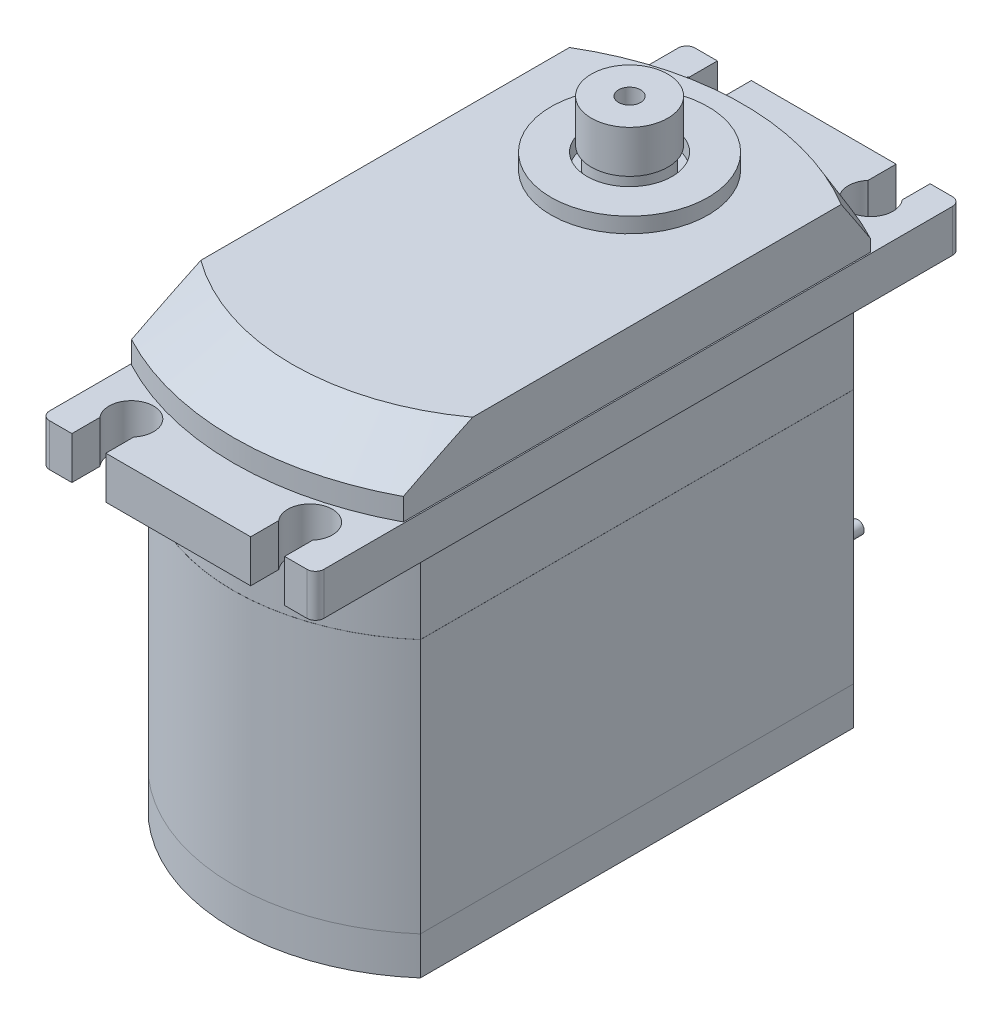
from build123d import *

# Parameters (mm, degrees)
SKETCH1_W            = 32
SKETCH1_H            = 63
BOSS_EXTRUDE1_DEPTH  = 35
SKETCH2_W            = 33
SKETCH2_H            = 63
BOSS_EXTRUDE2_DEPTH  = 7.5
BOSS_EXTRUDE3_DEPTH  = 5
CUT_EXTRUDE2_REACH   = 65.028
SKETCH6_W            = 63
SKETCH6_H            = 7.5
CUT_EXTRUDE3_DEPTH   = 0.5
SKETCH7_W            = 63
SKETCH7_H            = 7.5
CUT_EXTRUDE4_DEPTH   = 0.5
SKETCH8_W            = 32
SKETCH8_H            = 55
BOSS_EXTRUDE4_DEPTH  = 6.6
SKETCH9_R            = 9.25
SKETCH9_R_2          = 5
BOSS_EXTRUDE5_DEPTH  = 1.8
SKETCH10_R           = 4
BOSS_EXTRUDE6_DEPTH  = 2.5
SKETCH11_R           = 4.5
SKETCH11_R_2         = 1.3
BOSS_EXTRUDE7_DEPTH  = 5
BOSS_EXTRUDE8_START  = 30.5
SKETCH12_W           = 7.5
SKETCH12_H           = 4.5
BOSS_EXTRUDE8_DEPTH  = 7
SKETCH13_R           = 0.75
BOSS_EXTRUDE11_DEPTH = 3
SKETCH14_W           = 51
SKETCH14_H           = 30
BOSS_EXTRUDE12_DEPTH = 0.01
SKETCH15_W           = 51
SKETCH15_H           = 30
BOSS_EXTRUDE13_DEPTH = 0.01
CHAMFER1_SIZE        = 4
CHAMFER1_SIZE2       = 6.92820323
CHAMFER2_SIZE        = 3
CHAMFER2_SIZE2       = 5.196152423
CUT_EXTRUDE7_DEPTH   = 4.5
BOSS_EXTRUDE15_START = -4.5
BOSS_EXTRUDE15_DEPTH = 30
FILLET3_R            = 1


with BuildPart() as part:
    # Sketch1 → Boss-Extrude1 (new body)
    with BuildSketch(Plane(origin=(0, 0, 0), x_dir=(1, 0, 0), z_dir=(0, 1, 0))):
        Rectangle(SKETCH1_W, SKETCH1_H)
    extrude(amount=BOSS_EXTRUDE1_DEPTH)

    # Sketch2 → Boss-Extrude2 (add)
    with BuildSketch(Plane(origin=(0, 35, 0), x_dir=(1, 0, 0), z_dir=(0, 1, 0))):
        Rectangle(SKETCH2_W, SKETCH2_H)
    extrude(amount=BOSS_EXTRUDE2_DEPTH)

    # Sketch4 → Boss-Extrude3 (add)
    with BuildSketch(Plane(origin=(0, 42.5, 0), x_dir=(1, 0, 0), z_dir=(0, 1, 0))):
        with BuildLine():
            ThreePointArc((8.370789008, -31.5), (10.525, -30.375), (12.679210992, -31.5))
            Line((12.679210992, -31.5), (16.15, -31.5))
            Line((16.15, -31.5), (16.15, 31.5))
            Line((16.15, 31.5), (12.679210992, 31.5))
            ThreePointArc((12.679210992, 31.5), (10.525, 30.375), (8.370789008, 31.5))
            Line((8.370789008, 31.5), (-8.370789008, 31.5))
            ThreePointArc((-8.370789008, 31.5), (-10.525, 30.375), (-12.679210992, 31.5))
            Line((-12.679210992, 31.5), (-16.15, 31.5))
            Line((-16.15, 31.5), (-16.15, -31.5))
            Line((-16.15, -31.5), (-12.679210992, -31.5))
            ThreePointArc((-12.679210992, -31.5), (-10.525, -30.375), (-8.370789008, -31.5))
            Line((-8.370789008, -31.5), (8.370789008, -31.5))
        make_face()
        with BuildLine():
            Line((8.525, -38), (8.525, -34.700183814))
            ThreePointArc((8.525, -34.700183814), (7.903042458, -33.126347328), (8.370789008, -31.5))
            Line((8.370789008, -31.5), (-8.370789008, -31.5))
            ThreePointArc((-8.370789008, -31.5), (-8.020461235, -32.21392712), (-7.9, -33))
            ThreePointArc((-7.9, -33), (-8.061199582, -33.905711047), (-8.525, -34.700183814))
            Line((-8.525, -34.700183814), (-8.525, -38))
            Line((-8.525, -38), (8.525, -38))
        make_face()
        with BuildLine():
            ThreePointArc((12.679210992, -31.5), (13.029538765, -32.21392712), (13.15, -33))
            Line((13.15, -33), (16.15, -33))
            Line((16.15, -33), (16.15, -31.5))
            Line((16.15, -31.5), (12.679210992, -31.5))
        make_face()
        with BuildLine():
            Line((16.15, -33), (13.15, -33))
            ThreePointArc((13.15, -33), (12.988800418, -33.905711047), (12.525, -34.700183814))
            Line((12.525, -34.700183814), (12.525, -38))
            Line((12.525, -38), (16.15, -38))
            Line((16.15, -38), (16.15, -33))
        make_face()
        with BuildLine():
            Line((-16.15, -38), (-12.525, -38))
            Line((-12.525, -38), (-12.525, -34.700183814))
            ThreePointArc((-12.525, -34.700183814), (-12.988800418, -33.905711047), (-13.15, -33))
            Line((-13.15, -33), (-16.15, -33))
            Line((-16.15, -33), (-16.15, -38))
        make_face()
        with BuildLine():
            ThreePointArc((-13.15, -33), (-13.029538765, -32.21392712), (-12.679210992, -31.5))
            Line((-12.679210992, -31.5), (-16.15, -31.5))
            Line((-16.15, -31.5), (-16.15, -33))
            Line((-16.15, -33), (-13.15, -33))
        make_face()
        with BuildLine():
            Line((13.15, 33), (16.15, 33))
            Line((16.15, 33), (16.15, 38))
            Line((16.15, 38), (12.525, 38))
            Line((12.525, 38), (12.525, 34.700183814))
            ThreePointArc((12.525, 34.700183814), (12.988800418, 33.905711047), (13.15, 33))
        make_face()
        with BuildLine():
            Line((12.679210992, 31.5), (16.15, 31.5))
            Line((16.15, 31.5), (16.15, 33))
            Line((16.15, 33), (13.15, 33))
            ThreePointArc((13.15, 33), (13.029538765, 32.21392712), (12.679210992, 31.5))
        make_face()
        with BuildLine():
            Line((-8.370789008, 31.5), (8.370789008, 31.5))
            ThreePointArc((8.370789008, 31.5), (7.903042458, 33.126347328), (8.525, 34.700183814))
            Line((8.525, 34.700183814), (8.525, 38))
            Line((8.525, 38), (-8.525, 38))
            Line((-8.525, 38), (-8.525, 34.700183814))
            ThreePointArc((-8.525, 34.700183814), (-8.061199582, 33.905711047), (-7.9, 33))
            ThreePointArc((-7.9, 33), (-8.020461235, 32.21392712), (-8.370789008, 31.5))
        make_face()
        with BuildLine():
            Line((-16.15, 33), (-16.15, 31.5))
            Line((-16.15, 31.5), (-12.679210992, 31.5))
            ThreePointArc((-12.679210992, 31.5), (-13.029538765, 32.21392712), (-13.15, 33))
            Line((-13.15, 33), (-16.15, 33))
        make_face()
        with BuildLine():
            Line((-16.15, 38), (-16.15, 33))
            Line((-16.15, 33), (-13.15, 33))
            ThreePointArc((-13.15, 33), (-12.988800418, 33.905711047), (-12.525, 34.700183814))
            Line((-12.525, 34.700183814), (-12.525, 38))
            Line((-12.525, 38), (-16.15, 38))
        make_face()
    extrude(amount=BOSS_EXTRUDE3_DEPTH)

    # Cut-Extrude2: up to this face of the body (flat: up to its plane)
    cut_extrude2_end = Plane(part.part.faces().sort_by_distance((14.438767606, 42.5, -34.862650995))[0])
    # Sketch5 → Cut-Extrude2 (cut, up to the picked face)
    with BuildSketch(Plane.XZ, mode=Mode.PRIVATE) as cut_extrude2_sk1:
        with BuildLine():
            ThreePointArc((0, 31.5), (8.544003745, 29.950676654), (16, 25.5))
            Line((16, 25.5), (16, 31.5))
            Line((16, 31.5), (0, 31.5))
        make_face()
    cut_extrude2_tool1 = split(extrude(cut_extrude2_sk1.sketch, amount=-CUT_EXTRUDE2_REACH, mode=Mode.PRIVATE), bisect_by=cut_extrude2_end, keep=Keep.BOTH, mode=Mode.PRIVATE)
    # Sketch5 → Cut-Extrude2 (cut, up to the picked face)
    with BuildSketch(Plane.XZ, mode=Mode.PRIVATE) as cut_extrude2_sk2:
        with BuildLine():
            Line((-16, 31.5), (-16, 25.5))
            ThreePointArc((-16, 25.5), (-8.544003745, 29.950676654), (0, 31.5))
            Line((0, 31.5), (-16, 31.5))
        make_face()
    cut_extrude2_tool2 = split(extrude(cut_extrude2_sk2.sketch, amount=-CUT_EXTRUDE2_REACH, mode=Mode.PRIVATE), bisect_by=cut_extrude2_end, keep=Keep.BOTH, mode=Mode.PRIVATE)
    # Sketch5 → Cut-Extrude2 (cut, up to the picked face)
    with BuildSketch(Plane.XZ, mode=Mode.PRIVATE) as cut_extrude2_sk3:
        with BuildLine():
            ThreePointArc((0, -31.5), (-8.544003745, -29.950676654), (-16, -25.5))
            Line((-16, -25.5), (-16, -31.5))
            Line((-16, -31.5), (0, -31.5))
        make_face()
    cut_extrude2_tool3 = split(extrude(cut_extrude2_sk3.sketch, amount=-CUT_EXTRUDE2_REACH, mode=Mode.PRIVATE), bisect_by=cut_extrude2_end, keep=Keep.BOTH, mode=Mode.PRIVATE)
    # Sketch5 → Cut-Extrude2 (cut, up to the picked face)
    with BuildSketch(Plane.XZ, mode=Mode.PRIVATE) as cut_extrude2_sk4:
        with BuildLine():
            Line((16, -31.5), (16, -25.5))
            ThreePointArc((16, -25.5), (8.544003745, -29.950676654), (0, -31.5))
            Line((0, -31.5), (16, -31.5))
        make_face()
    cut_extrude2_tool4 = split(extrude(cut_extrude2_sk4.sketch, amount=-CUT_EXTRUDE2_REACH, mode=Mode.PRIVATE), bisect_by=cut_extrude2_end, keep=Keep.BOTH, mode=Mode.PRIVATE)
    add(cut_extrude2_tool1.solids().sort_by(Axis((12.10535, 0, 29.74568), (0, 1, 0)))[0], mode=Mode.SUBTRACT)
    add(cut_extrude2_tool2.solids().sort_by(Axis((-12.10535, 0, 29.74568), (0, 1, 0)))[0], mode=Mode.SUBTRACT)
    add(cut_extrude2_tool3.solids().sort_by(Axis((-12.10535, 0, -29.74568), (0, 1, 0)))[0], mode=Mode.SUBTRACT)
    add(cut_extrude2_tool4.solids().sort_by(Axis((12.10535, 0, -29.74568), (0, 1, 0)))[0], mode=Mode.SUBTRACT)

    # Sketch6 → Cut-Extrude3 (cut)
    with BuildSketch(Plane.ZY.offset(16.5)):
        with Locations((0, 38.75)):
            Rectangle(SKETCH6_W, SKETCH6_H)
    extrude(amount=-CUT_EXTRUDE3_DEPTH, mode=Mode.SUBTRACT)

    # Sketch7 → Cut-Extrude4 (cut)
    with BuildSketch(Plane(origin=(16.5, 0, 0), x_dir=(0, 0, -1), z_dir=(1, 0, 0))):
        with Locations((0, 38.75)):
            Rectangle(SKETCH7_W, SKETCH7_H)
    extrude(amount=-CUT_EXTRUDE4_DEPTH, mode=Mode.SUBTRACT)

    # Sketch8 → Boss-Extrude4 (add)
    with BuildSketch(Plane(origin=(0, 47.5, 0), x_dir=(1, 0, 0), z_dir=(0, 1, 0))):
        Rectangle(SKETCH8_W, SKETCH8_H)
        with BuildLine():
            ThreePointArc((-16, 27.5), (0, 31.5), (16, 27.5))
            Line((16, 27.5), (-16, 27.5))
        make_face()
        with BuildLine():
            ThreePointArc((-16, -27.5), (0, -31.5), (16, -27.5))
            Line((16, -27.5), (-16, -27.5))
        make_face()
    extrude(amount=BOSS_EXTRUDE4_DEPTH)

    # Sketch9 → Boss-Extrude5 (add)
    with BuildSketch(Plane(origin=(0, 54.1, 0), x_dir=(1, 0, 0), z_dir=(0, 1, 0))):
        with Locations(Location((0, 15.138499844, 0), (0, 0, 270))):
            Circle(SKETCH9_R)
        with Locations(Location((0, 15.138499844, 0), (0, 0, 270))):
            Circle(SKETCH9_R_2, mode=Mode.SUBTRACT)
    extrude(amount=BOSS_EXTRUDE5_DEPTH)

    # Sketch10 → Boss-Extrude6 (add)
    with BuildSketch(Plane(origin=(0, 54.1, 0), x_dir=(1, 0, 0), z_dir=(0, 1, 0))):
        with Locations(Location((0, 15.138499844, 0), (0, 0, 270))):
            Circle(SKETCH10_R)
    extrude(amount=BOSS_EXTRUDE6_DEPTH)

    # Sketch11 → Boss-Extrude7 (add)
    with BuildSketch(Plane(origin=(0, 56.6, 0), x_dir=(1, 0, 0), z_dir=(0, 1, 0))):
        with Locations(Location((0, 15.138499844, 0), (0, 0, 270))):
            Circle(SKETCH11_R)
        with Locations(Location((0, 15.138499844, 0), (0, 0, 270))):
            Circle(SKETCH11_R_2, mode=Mode.SUBTRACT)
    extrude(amount=BOSS_EXTRUDE7_DEPTH)

    # Sketch12 → Boss-Extrude8 (add)
    with BuildSketch(Plane.XY.offset(BOSS_EXTRUDE8_START)):
        with Locations((0, 5.75)):
            Rectangle(SKETCH12_W, SKETCH12_H)
    boss_extrude8 = extrude(amount=BOSS_EXTRUDE8_DEPTH)

    # Sketch13 → Boss-Extrude11 (add)
    with BuildSketch(Plane.XY.offset(37.5)):
        with BuildLine():
            ThreePointArc((-0.76, 5.75), (-0.979669914, 6.280330086), (-1.51, 6.5))
            ThreePointArc((-1.51, 6.5), (-1.995258093, 6.321860633), (-2.25, 5.872065556))
            Line((-2.25, 5.872065556), (-2.25, 5.627934444))
            ThreePointArc((-2.25, 5.627934444), (-1.995258093, 5.178139367), (-1.51, 5))
            ThreePointArc((-1.51, 5), (-0.979669914, 5.219669914), (-0.76, 5.75))
        make_face()
        with BuildLine():
            Line((-2.25, 5.627934444), (-2.25, 5.872065556))
            ThreePointArc((-2.25, 5.872065556), (-2.26, 5.75), (-2.25, 5.627934444))
        make_face()
        with Locations((0, 5.75)):
            Circle(SKETCH13_R)
        with BuildLine():
            ThreePointArc((2.25, 5.872065556), (1.995258093, 6.321860633), (1.51, 6.5))
            ThreePointArc((1.51, 6.5), (0.76, 5.75), (1.51, 5))
            ThreePointArc((1.51, 5), (1.995258093, 5.178139367), (2.25, 5.627934444))
            Line((2.25, 5.627934444), (2.25, 5.872065556))
        make_face()
        with BuildLine():
            ThreePointArc((2.26, 5.75), (2.257495819, 5.811237244), (2.25, 5.872065556))
            Line((2.25, 5.872065556), (2.25, 5.627934444))
            ThreePointArc((2.25, 5.627934444), (2.257495819, 5.688762756), (2.26, 5.75))
        make_face()
    boss_extrude11 = extrude(amount=BOSS_EXTRUDE11_DEPTH)

    # Sketch14 → Boss-Extrude12 (add)
    with BuildSketch(Plane.ZY.offset(16)):
        with Locations((0, 19.5)):
            Rectangle(SKETCH14_W, SKETCH14_H)
    extrude(amount=BOSS_EXTRUDE12_DEPTH)

    # Sketch15 → Boss-Extrude13 (add)
    with BuildSketch(Plane(origin=(16, 0, 0), x_dir=(0, 0, -1), z_dir=(1, 0, 0))):
        with Locations((0, 19.5)):
            Rectangle(SKETCH15_W, SKETCH15_H)
    extrude(amount=BOSS_EXTRUDE13_DEPTH)

    # Chamfer1
    chamfer1_edges = [part.edges().sort_by_distance(p)[0] for p in [
        (0, 54.1, 31.5),
    ]]
    chamfer1_side = [part.faces().sort_by_distance(p)[0] for p in [
        (0, 50.8, 31.5),
    ]]
    chamfer(chamfer1_edges, length=CHAMFER1_SIZE, length2=CHAMFER1_SIZE2, reference=chamfer1_side[0])

    # Chamfer2
    chamfer2_edges = [part.edges().sort_by_distance(p)[0] for p in [
        (0, 54.1, -31.5),
    ]]
    chamfer2_side = [part.faces().sort_by_distance(p)[0] for p in [
        (0, 54.1, -1.479782265),
    ]]
    chamfer(chamfer2_edges, length=CHAMFER2_SIZE, length2=CHAMFER2_SIZE2, reference=chamfer2_side[0])

    # Sketch19 → Cut-Extrude7 (cut)
    with BuildSketch(Plane.XZ.offset(-3.5)):
        with BuildLine():
            Line((-3.75, 37.5), (-3.75, 43.994534201))
            Line((-3.75, 43.994534201), (6.56874326, 45.419267567))
            Line((6.56874326, 45.419267567), (3.75, 37.5))
            Line((3.75, 37.5), (3.75, 31.209308184))
            ThreePointArc((3.75, 31.209308184), (0, 31.5), (-3.75, 31.209308184))
            Line((-3.75, 31.209308184), (-3.75, 37.5))
        make_face()
    extrude(amount=-CUT_EXTRUDE7_DEPTH, mode=Mode.SUBTRACT)

    # Sketch17 → Boss-Extrude15 (add)
    with BuildSketch(Plane.XZ.offset(BOSS_EXTRUDE15_START)):
        with BuildLine():
            Line((-16.026644481, 25.49), (16.026644481, 25.49))
            ThreePointArc((16.026644481, 25.49), (0, 31.51), (-16.026644481, 25.49))
        make_face()
        with BuildLine():
            Line((-16, 25.5), (16, 25.5))
            ThreePointArc((16, 25.5), (0, 31.5), (-16, 25.5))
        make_face(mode=Mode.SUBTRACT)
    boss_extrude15 = extrude(amount=-BOSS_EXTRUDE15_DEPTH)

    # Mirror1: Boss-Extrude15 across plane
    add(boss_extrude15.mirror(Plane.XY))

    # Fillet3
    fillet3_edges = [part.edges().sort_by_distance(p)[0] for p in [
        (-16.15, 45, -38),
        (-16.15, 45, 38),
        (16.15, 45, 38),
        (16.15, 45, -38),
    ]]
    fillet(fillet3_edges, radius=FILLET3_R)

    # Mirror2: Boss-Extrude8, Boss-Extrude11 across plane
    add(boss_extrude8.mirror(Plane.XY))
    add(boss_extrude11.mirror(Plane.XY))


solid = part.part
